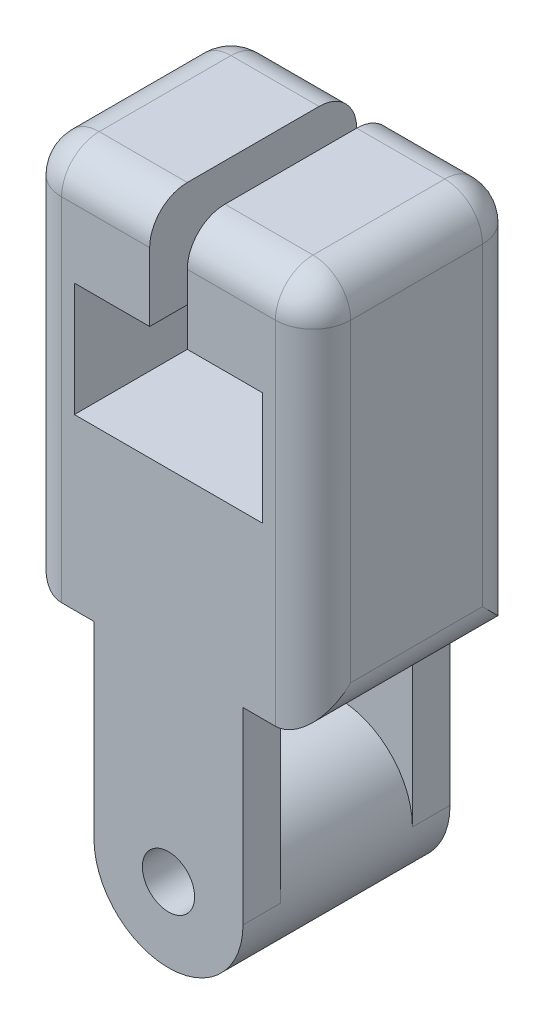
from build123d import *

# Parameters (mm, degrees)
BOSS_EXTRUDE1_DEPTH = 69.85
SKETCH2_W           = 50.292
SKETCH2_H           = 12.7
BOSS_EXTRUDE2_DEPTH = 63.5
SKETCH5_R           = 25.146
BOSS_EXTRUDE3_DEPTH = 69.85
SKETCH8_R           = 8.808520998
CUT_EXTRUDE2_DEPTH  = 251.552300113
FILLET7_R           = 12.7


with BuildPart() as part:
    # Sketch1 → Boss-Extrude1 (new body)
    with BuildSketch(Plane.XY):
        Polygon((0, 0), (42.418, 0), (42.418, -35.744914454), (17.018, -35.744914454), (17.018, -74.168), (80.518, -74.168), (80.518, -36.068), (55.118, -36.068), (55.118, 0), (97.536, 0), (97.536, -131.318), (0, -131.318), align=None)
    extrude(amount=BOSS_EXTRUDE1_DEPTH)

    # Sketch2 → Boss-Extrude2 (add)
    with BuildSketch(Plane.XZ.offset(131.318)):
        with Locations((48.768, 6.35)):
            Rectangle(SKETCH2_W, SKETCH2_H)
        with Locations((48.768, 63.5)):
            Rectangle(SKETCH2_W, SKETCH2_H)
    extrude(amount=BOSS_EXTRUDE2_DEPTH)

    # Sketch5 → Boss-Extrude3 (add)
    with BuildSketch(Plane(origin=(0, 0, 0), x_dir=(-1, 0, 0), z_dir=(0, 0, -1))):
        with Locations((-48.768, -194.818)):
            Circle(SKETCH5_R)
    extrude(amount=-BOSS_EXTRUDE3_DEPTH)

    # Sketch8 → Cut-Extrude2 (cut, through all)
    with BuildSketch(Plane.XY.offset(69.85)):
        with Locations((48.768, -194.818)):
            Circle(SKETCH8_R)
    extrude(amount=-CUT_EXTRUDE2_DEPTH, mode=Mode.SUBTRACT)

    # Fillet7
    fillet7_edges = [part.edges().sort_by_distance(p)[0] for p in [
        (21.209, 0, 0),
        (97.536, -65.659, 69.85),
        (76.327, 0, 0),
        (97.536, -65.659, 0),
        (0, -65.659, 0),
        (76.327, 0, 69.85),
        (0, 0, 34.925),
        (97.536, 0, 34.925),
        (97.536, -131.318, 34.925),
        (0, -131.318, 34.925),
        (21.209, 0, 69.85),
        (0, -65.659, 69.85),
    ]]
    fillet(fillet7_edges, radius=FILLET7_R)


solid = part.part
